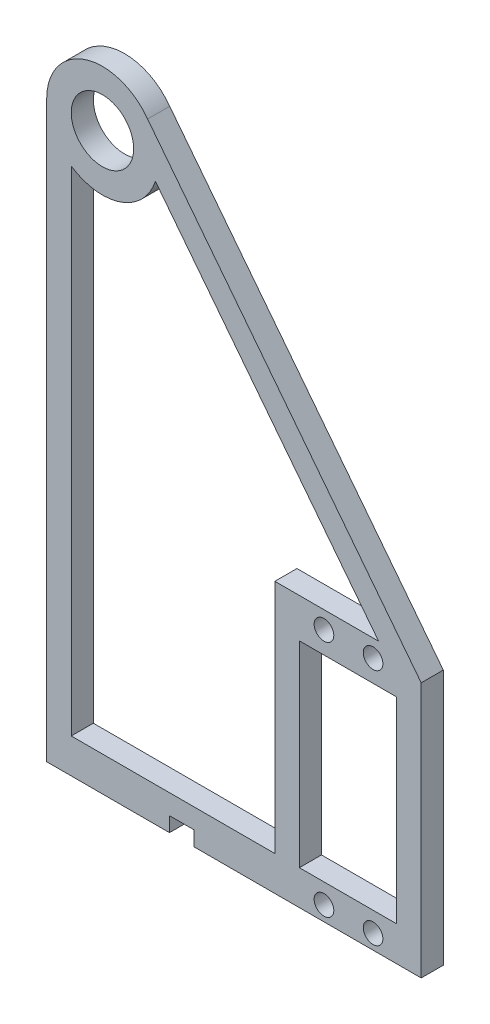
from build123d import *

# Parameters (mm, degrees)
SKETCH1_R           = 6.35
BOSS_EXTRUDE1_DEPTH = 4.5
SKETCH2_R           = 2
CUT_EXTRUDE1_DEPTH  = 134.826613571
SKETCH3_W           = 5
SKETCH3_H           = 3
CUT_EXTRUDE2_DEPTH  = 134.826613571


with BuildPart() as part:
    # Sketch1 → Boss-Extrude1 (new body)
    with BuildSketch(Plane.XY):
        with BuildLine():
            Line((64.9, -114.9), (64.9, -64.9))
            Line((64.9, -64.9), (9.197116485, 6.650981008))
            ThreePointArc((9.197116485, 6.650981008), (-3.49537036, 10.798374232), (-11.35, 0))
            Line((-11.35, 0), (-11.35, -114.9))
            Line((-11.35, -114.9), (-11.35, -116.95))
            Line((-11.35, -116.95), (35.1, -116.95))
            Line((35.1, -116.95), (64.9, -116.95))
            Line((64.9, -116.95), (64.9, -114.9))
        make_face()
        with BuildLine():
            Line((35.1, -61.9), (35.1, -64.9))
            Line((35.1, -64.9), (35.1, -109.9))
            Line((35.1, -109.9), (-6.35, -109.9))
            Line((-6.35, -109.9), (-6.35, -9.407443861))
            ThreePointArc((-6.35, -9.407443861), (3.681868281, -10.736216557), (10.786933356, -3.530519618))
            Line((10.786933356, -3.530519618), (56.22793669, -61.9))
            Line((56.22793669, -61.9), (35.1, -61.9))
        make_face(mode=Mode.SUBTRACT)
        Polygon((40.1, -69.9), (59.9, -69.9), (59.9, -100), (59.9, -109.9), (50, -109.9), (40.1, -109.9), (40.1, -100), align=None, mode=Mode.SUBTRACT)
        Circle(SKETCH1_R, mode=Mode.SUBTRACT)
    extrude(amount=BOSS_EXTRUDE1_DEPTH)

    # Sketch2 → Cut-Extrude1 (cut, through all)
    with BuildSketch(Plane(origin=(0, 0, 0), x_dir=(-1, 0, 0), z_dir=(0, 0, -1))):
        with Locations((-55.1, -113.95)):
            Circle(SKETCH2_R)
        with Locations((-45.1, -113.95)):
            Circle(SKETCH2_R)
        with Locations((-45.1, -65.45)):
            Circle(SKETCH2_R)
        with Locations((-55.1, -65.45)):
            Circle(SKETCH2_R)
    extrude(amount=-CUT_EXTRUDE1_DEPTH, mode=Mode.SUBTRACT)

    # Sketch3 → Cut-Extrude2 (cut, through all)
    with BuildSketch(Plane.XY.offset(4.5)):
        with Locations((16.15, -115.45)):
            Rectangle(SKETCH3_W, SKETCH3_H)
    extrude(amount=-CUT_EXTRUDE2_DEPTH, mode=Mode.SUBTRACT)


solid = part.part
